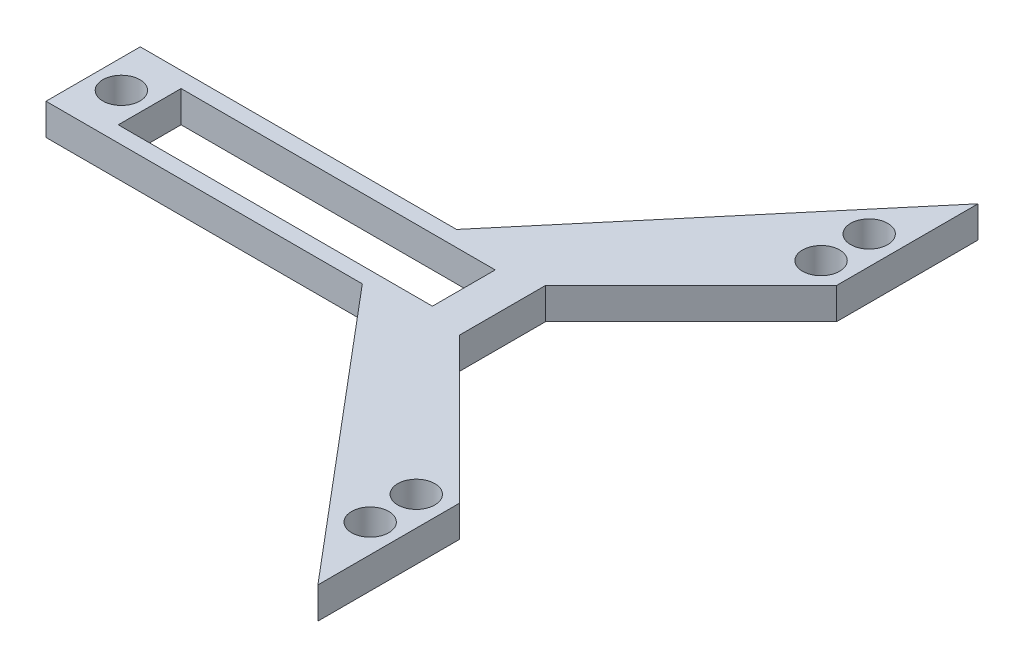
from build123d import *

# Parameters (mm, degrees)
BOSS_EXTRUDE2_DEPTH = 2.54
SKETCH7_R           = 1.4986
SKETCH7_W           = 25.4
SKETCH7_H           = 5.08
CUT_EXTRUDE1_DEPTH  = 2.54


with BuildPart() as part:
    # Sketch1 → Boss-Extrude2 (new body)
    with BuildSketch(Plane(origin=(0, 0, 0), x_dir=(1, 0, 0), z_dir=(0, 1, 0))):
        Polygon((3.221868426, 6.029765094), (14.988277627, 17.796174295), (14.988277627, 29.226174295), (-4.295819053, 6.35), (-29.8704, 6.35), (-29.8704, -1.27), (-4.295819053, -1.27), (14.988277627, -24.146174295), (14.988277627, -12.716174295), (3.221868426, -0.949765094), align=None)
    extrude(amount=BOSS_EXTRUDE2_DEPTH)

    # Sketch7 → Cut-Extrude1 (cut)
    with BuildSketch(Plane(origin=(0, 2.54, 0), x_dir=(1, 0, 0), z_dir=(0, 1, 0))):
        with Locations(Location((-27.5844, 2.54, 0), (0, 0, 270))):
            Circle(SKETCH7_R)
        with Locations(Location((12.702277627, 22.713311162, 0), (0, 0, 270))):
            Circle(SKETCH7_R)
        with Locations(Location((12.622030753, 18.904156343, 0), (0, 0, 270))):
            Circle(SKETCH7_R)
        with Locations(Location((12.622030753, -13.824156343, 0), (0, 0, 90))):
            Circle(SKETCH7_R)
        with Locations(Location((12.702277627, -17.633311162, 0), (0, 0, 90))):
            Circle(SKETCH7_R)
        with Locations((-12.5984, 2.54)):
            Rectangle(SKETCH7_W, SKETCH7_H)
    extrude(amount=-CUT_EXTRUDE1_DEPTH, mode=Mode.SUBTRACT)


solid = part.part
